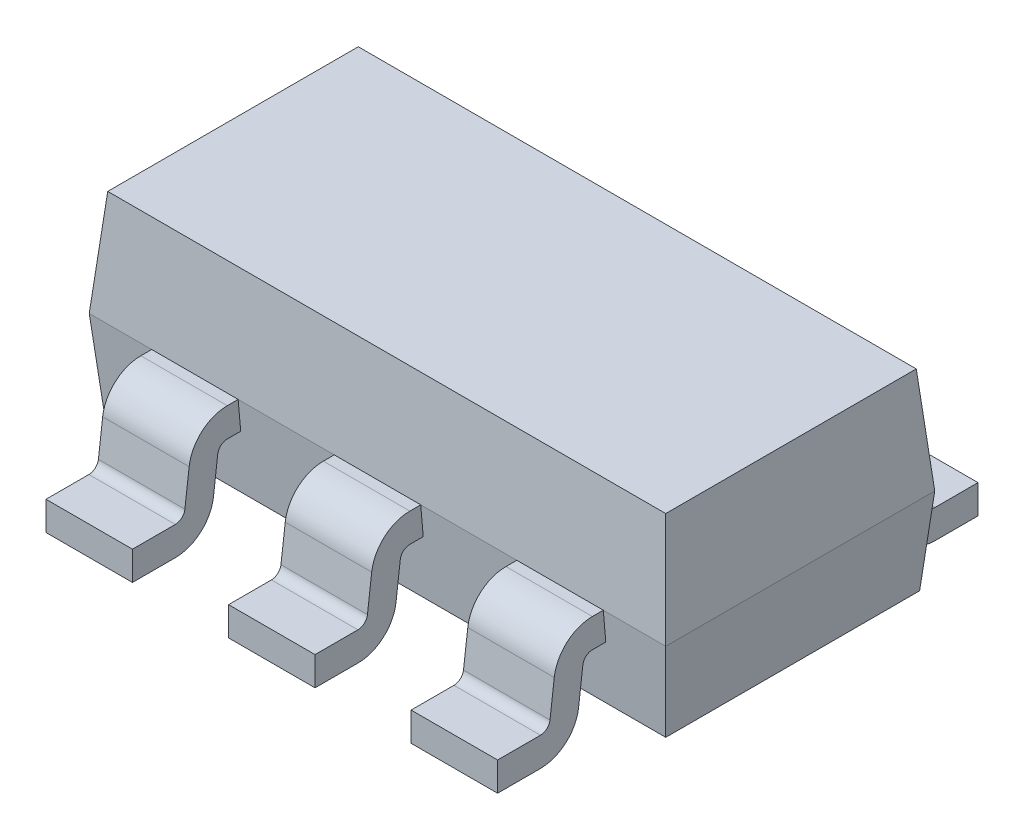
from build123d import *

# Parameters (mm, degrees)
SKETCH1_W                = 3
SKETCH1_H                = 1.4
EXTRUDE1_DEPTH           = 0.55
EXTRUDE1_TAPER           = 5
EXTRUDE1_OTHER_WAY_DEPTH = 0.45
EXTRUDE1_OTHER_WAY_TAPER = 5
EXTRUDE2_DEPTH           = 0.225
EXTRUDE2_DEPTH_BACK      = 0.225
EXTRUDE3_START           = 0.95
EXTRUDE3_DEPTH           = 0.225
MIRROR_START             = 0.95
MIRROR_1_COPY_1_DEPTH    = 0.225
FILLET1_R                = 0.05
FILLET2_R                = 0.2


with BuildPart() as part:
    # Sketch1 → Extrude1 (new body)
    with BuildSketch(Plane(origin=(0, 0, 0), x_dir=(1, 0, 0), z_dir=(0, 1, 0))):
        Rectangle(SKETCH1_W, SKETCH1_H)
    extrude(amount=EXTRUDE1_DEPTH, taper=EXTRUDE1_TAPER)

    # Sketch1 → Extrude1 other way (add)
    with BuildSketch(Plane(origin=(0, 0, 0), x_dir=(1, 0, 0), z_dir=(0, 1, 0))):
        Rectangle(SKETCH1_W, SKETCH1_H)
    extrude(amount=-EXTRUDE1_OTHER_WAY_DEPTH, taper=EXTRUDE1_OTHER_WAY_TAPER)

    # Sketch2 → Extrude2 (add, two sides: drawn at the far end of the back side and taken through both)
    with BuildSketch(Plane(origin=(0, 0, 0), x_dir=(0, 0, -1), z_dir=(1, 0, 0)).offset(-EXTRUDE2_DEPTH_BACK)):
        Polygon((-0.585273808, 0), (-0.933594965, 0), (-0.98270879, -0.4), (-1.25, -0.4), (-1.25, -0.55), (-0.85, -0.55), (-0.800886176, -0.15), (-0.585273808, -0.15), align=None)
    extrude(amount=EXTRUDE2_DEPTH + EXTRUDE2_DEPTH_BACK)

    # Sketch2<3> → Extrude3 (add, symmetric)
    with BuildSketch(Plane(origin=(0, 0, 0), x_dir=(0, 0, -1), z_dir=(1, 0, 0)).offset(EXTRUDE3_START)):
        Polygon((0.585273808, 0), (0.933594965, 0), (0.98270879, -0.4), (1.25, -0.4), (1.25, -0.55), (0.85, -0.55), (0.800886176, -0.15), (0.585273808, -0.15), align=None)
    extrude3 = extrude(amount=EXTRUDE3_DEPTH, both=True)

    # Mirror1: Extrude3 across plane
    add(extrude3.mirror(Plane(origin=(0, 0, 0), x_dir=(0, 0, 1), z_dir=(1, 0, 0))))

    # Зеркальное отражение1: Extrude3 across plane
    add(extrude3.mirror(Plane.XY))

    # Зеркальное отражение1 copy 1 sketch → Зеркальное отражение1 copy 1 (add, symmetric)
    with BuildSketch(Plane.ZY.offset(MIRROR_START)):
        Polygon((0.585273808, 0), (0.933594965, 0), (0.98270879, -0.4), (1.25, -0.4), (1.25, -0.55), (0.85, -0.55), (0.800886176, -0.15), (0.585273808, -0.15), align=None)
    extrude(amount=MIRROR_1_COPY_1_DEPTH, both=True)

    # Fillet1
    fillet1_edges = [part.edges().sort_by_distance(p)[0] for p in [
        (0.95, -0.4, 0.98270879),
        (0.95, -0.15, 0.800886176),
        (-0.95, -0.15, 0.800886176),
        (-0.95, -0.4, 0.98270879),
        (0, -0.4, 0.98270879),
        (0, -0.15, 0.800886176),
        (0.95, -0.15, -0.800886176),
        (0.95, -0.4, -0.98270879),
        (-0.95, -0.4, -0.98270879),
        (-0.95, -0.15, -0.800886176),
    ]]
    fillet(fillet1_edges, radius=FILLET1_R)

    # Fillet2
    fillet2_edges = [part.edges().sort_by_distance(p)[0] for p in [
        (0.95, 0, 0.933594965),
        (0.95, -0.55, 0.85),
        (-0.95, 0, 0.933594965),
        (-0.95, -0.55, 0.85),
        (0, 0, 0.933594965),
        (0, -0.55, 0.85),
        (0.95, 0, -0.933594965),
        (0.95, -0.55, -0.85),
        (-0.95, 0, -0.933594965),
        (-0.95, -0.55, -0.85),
    ]]
    fillet(fillet2_edges, radius=FILLET2_R)


solid = part.part
